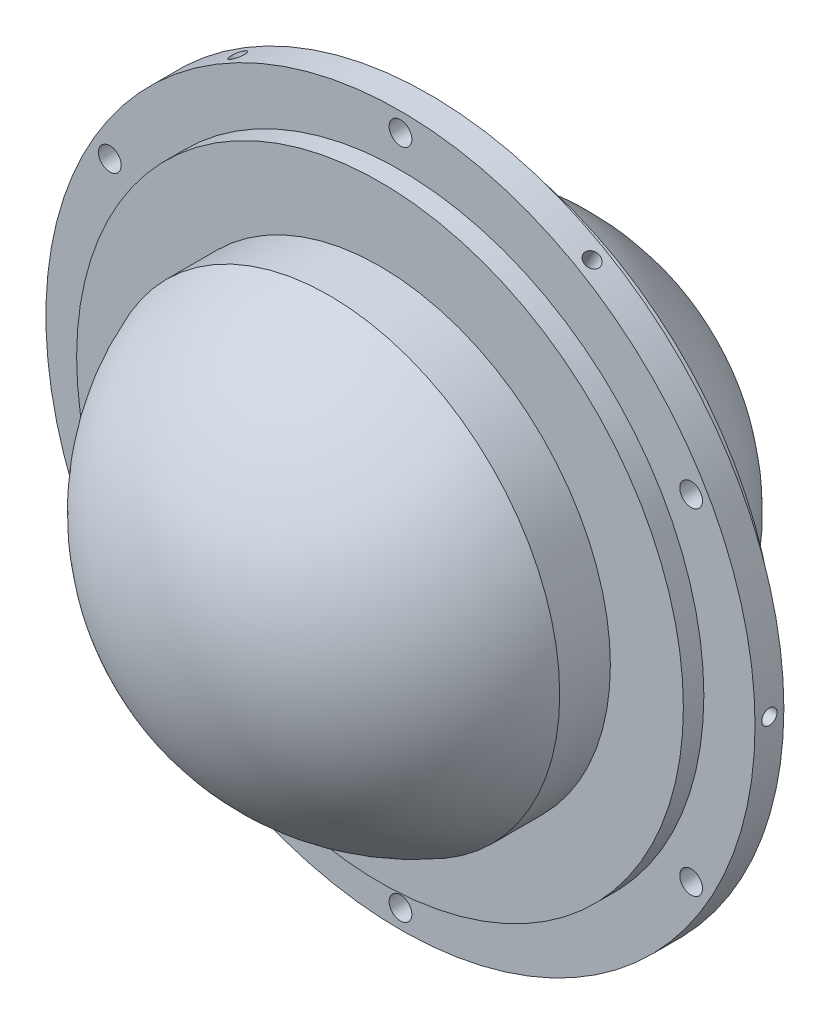
from build123d import *

# Parameters (mm, degrees)
CUT_EXTRUDE1_START = -80
SKETCH6_R          = 2
CUT_EXTRUDE1_DEPTH = 68.253319148
SKETCH7_R          = 3
CUT_EXTRUDE2_DEPTH = 149.969232185
CIRPATTERN1_COUNT  = 6


with BuildPart() as part:
    # Sketch1 → Revolve1 (revolve)
    with BuildSketch(Plane(origin=(0, 0, 0), x_dir=(0, 0, -1), z_dir=(1, 0, 0)), mode=Mode.PRIVATE) as revolve1_sk:
        with BuildLine():
            Line((64.8, 0), (-64.8, 0))
            ThreePointArc((-64.8, 0), (-53.198891339, 36.998891339), (-22.549445669, 60.75))
            Line((-22.549445669, 60.75), (-9.19, 60.75))
            Line((-9.19, 60.75), (-9.19, 80))
            Line((-9.19, 80), (-3.79, 80))
            Line((-3.79, 80), (-3.79, 93.5))
            Line((-3.79, 93.5), (3.81, 93.5))
            Line((3.81, 93.5), (3.81, 84))
            Line((3.81, 84), (11.41, 84))
            Line((11.41, 84), (11.41, 70))
            Line((11.41, 70), (16.31, 70))
            Line((16.31, 70), (16.31, 60.75))
            Line((16.31, 60.75), (22.549445669, 60.75))
            ThreePointArc((22.549445669, 60.75), (53.198891339, 36.998891339), (64.8, 0))
        make_face()
    revolve(revolve1_sk.sketch.rotate(Axis((0, 0, 0), (0, 0, -1)), 90), axis=Axis((0, 0, 0), (0, 0, -1)))

    # Sketch6 → Cut-Extrude1 (cut, through all)
    with BuildSketch(Plane(origin=(0, 0, 0), x_dir=(0, 0, -1), z_dir=(1, 0, 0)).offset(CUT_EXTRUDE1_START)):
        Circle(SKETCH6_R)
    cut_extrude1 = extrude(amount=-CUT_EXTRUDE1_DEPTH, mode=Mode.SUBTRACT)

    # Sketch7 → Cut-Extrude2 (cut, through all)
    with BuildSketch(Plane(origin=(0, 0, -3.81), x_dir=(-1, 0, 0), z_dir=(0, 0, -1))):
        with Locations((0, 88.5)):
            Circle(SKETCH7_R)
    cut_extrude2 = extrude(amount=-CUT_EXTRUDE2_DEPTH, mode=Mode.SUBTRACT)

    # CirPattern1: Cut-Extrude1, Cut-Extrude2 ×6 about axis
    cirpattern1_axis = Axis((0, 0, 0), (0, 0, 1))
    add([cut_extrude1.rotate(cirpattern1_axis, i * 360 / CIRPATTERN1_COUNT) for i in range(1, CIRPATTERN1_COUNT)], mode=Mode.SUBTRACT)
    add([cut_extrude2.rotate(cirpattern1_axis, i * 360 / CIRPATTERN1_COUNT) for i in range(1, CIRPATTERN1_COUNT)], mode=Mode.SUBTRACT)


solid = part.part
